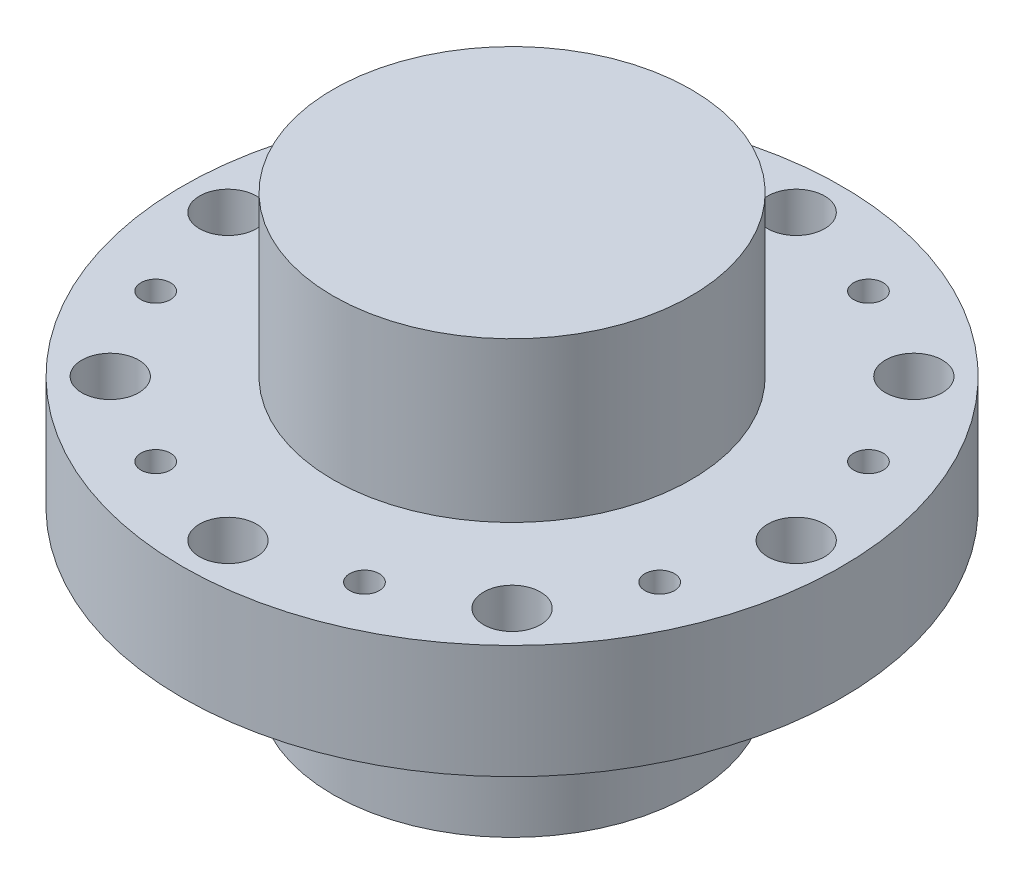
from build123d import *

# Parameters (mm, degrees)
SKETCH1_R                  = 15.75
BOSS_EXTRUDE1_DEPTH        = 14
SKETCH2_R                  = 29
BOSS_EXTRUDE2_DEPTH        = 10
SKETCH4_R                  = 2.5
CUT_EXTRUDE1_DEPTH         = 5
SKETCH5_R                  = 1.295
CUT_EXTRUDE2_DEPTH         = 46.19955752
CIRPATTERN1_COUNT          = 8
SKETCH6_R                  = 15.75
BOSS_EXTRUDE3_DEPTH        = 14
LOBAC_M25_THROUGH_X8_START = 14
SKETCH9_R                  = 1.3
LOBAC_M25_THROUGH_X8_DEPTH = 10
LOBAC_M25_CBORE_X8_START   = 14
SKETCH10_R                 = 2.5
LOBAC_M25_CBORE_X8_DEPTH   = 5


with BuildPart() as part:
    # Sketch1 → Boss-Extrude1 (new body)
    with BuildSketch(Plane(origin=(0, 0, 0), x_dir=(1, 0, 0), z_dir=(0, 1, 0))):
        with Locations(Location((0, 0, 0), (0, 0, 270))):
            Circle(SKETCH1_R)
    extrude(amount=BOSS_EXTRUDE1_DEPTH)

    # Sketch2 → Boss-Extrude2 (add)
    with BuildSketch(Plane(origin=(0, 14, 0), x_dir=(1, 0, 0), z_dir=(0, 1, 0))):
        with Locations(Location((0, 0, 0), (0, 0, 270))):
            Circle(SKETCH2_R)
    extrude(amount=BOSS_EXTRUDE2_DEPTH)

    # Sketch4 → Cut-Extrude1 (cut)
    with BuildSketch(Plane(origin=(0, 24, 0), x_dir=(1, 0, 0), z_dir=(0, 1, 0))):
        with Locations(Location((0, 25, 0), (0, 0, 270))):
            Circle(SKETCH4_R)
    cut_extrude1 = extrude(amount=-CUT_EXTRUDE1_DEPTH, mode=Mode.SUBTRACT)

    # Sketch5 → Cut-Extrude2 (cut, through all)
    with BuildSketch(Plane(origin=(0, 19, 0), x_dir=(1, 0, 0), z_dir=(0, 1, 0))):
        with Locations(Location((0, 25, 0), (0, 0, 270))):
            Circle(SKETCH5_R)
    cut_extrude2 = extrude(amount=-CUT_EXTRUDE2_DEPTH, mode=Mode.SUBTRACT)

    # CirPattern1: Cut-Extrude1, Cut-Extrude2 ×8 about axis
    cirpattern1_axis = Axis((0, 0, 0), (0, 1, 0))
    add([cut_extrude1.rotate(cirpattern1_axis, i * 360 / CIRPATTERN1_COUNT) for i in range(1, CIRPATTERN1_COUNT)], mode=Mode.SUBTRACT)
    add([cut_extrude2.rotate(cirpattern1_axis, i * 360 / CIRPATTERN1_COUNT) for i in range(1, CIRPATTERN1_COUNT)], mode=Mode.SUBTRACT)

    # Sketch6 → Boss-Extrude3 (add)
    with BuildSketch(Plane(origin=(0, 24, 0), x_dir=(1, 0, 0), z_dir=(0, 1, 0))):
        with Locations(Location((0, 0, 0), (0, 0, 270))):
            Circle(SKETCH6_R)
    extrude(amount=BOSS_EXTRUDE3_DEPTH)

    # Sketch9 → LoBac-M25-Through-x8 (cut)
    with BuildSketch(Plane(origin=(0, 0, 0), x_dir=(1, 0, 0), z_dir=(0, 1, 0)).offset(LOBAC_M25_THROUGH_X8_START)):
        with Locations(Location((22.17310878, -9.184402377, 0), (0, 0, 270))):
            Circle(SKETCH9_R)
        with Locations(Location((9.184402377, -22.17310878, 0), (0, 0, 270))):
            Circle(SKETCH9_R)
        with Locations(Location((-9.184402377, -22.17310878, 0), (0, 0, 270))):
            Circle(SKETCH9_R)
        with Locations(Location((-22.17310878, -9.184402377, 0), (0, 0, 270))):
            Circle(SKETCH9_R)
        with Locations(Location((-22.17310878, 9.184402377, 0), (0, 0, 270))):
            Circle(SKETCH9_R)
        with Locations(Location((-9.184402377, 22.17310878, 0), (0, 0, 270))):
            Circle(SKETCH9_R)
        with Locations(Location((9.184402377, 22.17310878, 0), (0, 0, 270))):
            Circle(SKETCH9_R)
        with Locations(Location((22.17310878, 9.184402377, 0), (0, 0, 270))):
            Circle(SKETCH9_R)
    extrude(amount=LOBAC_M25_THROUGH_X8_DEPTH, mode=Mode.SUBTRACT)

    # Sketch10 → LoBac-M25-CBore-x8 (cut)
    with BuildSketch(Plane(origin=(0, 0, 0), x_dir=(1, 0, 0), z_dir=(0, 1, 0)).offset(LOBAC_M25_CBORE_X8_START)):
        with Locations(Location((22.17310878, -9.184402377, 0), (0, 0, 270))):
            Circle(SKETCH10_R)
        with Locations(Location((9.184402377, -22.17310878, 0), (0, 0, 270))):
            Circle(SKETCH10_R)
        with Locations(Location((-9.184402377, -22.17310878, 0), (0, 0, 270))):
            Circle(SKETCH10_R)
        with Locations(Location((-22.17310878, -9.184402377, 0), (0, 0, 270))):
            Circle(SKETCH10_R)
        with Locations(Location((-22.17310878, 9.184402377, 0), (0, 0, 270))):
            Circle(SKETCH10_R)
        with Locations(Location((-9.184402377, 22.17310878, 0), (0, 0, 270))):
            Circle(SKETCH10_R)
        with Locations(Location((9.184402377, 22.17310878, 0), (0, 0, 270))):
            Circle(SKETCH10_R)
        with Locations(Location((22.17310878, 9.184402377, 0), (0, 0, 270))):
            Circle(SKETCH10_R)
    extrude(amount=LOBAC_M25_CBORE_X8_DEPTH, mode=Mode.SUBTRACT)


solid = part.part
